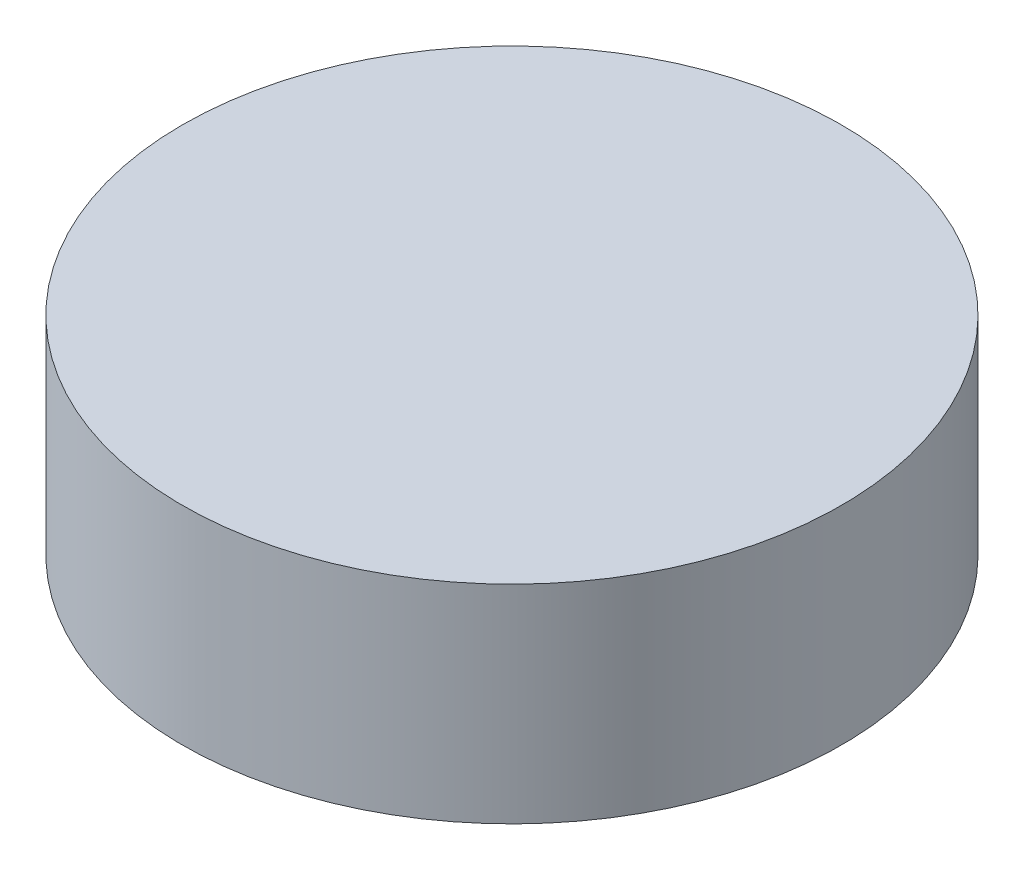
from build123d import *

# Parameters (mm, degrees)
SKETCH1_W = 6.35
SKETCH1_H = 4


with BuildPart() as part:
    # Sketch1 → Revolve1 (revolve)
    with BuildSketch(Plane.XY):
        with Locations((-3.175, 2)):
            Rectangle(SKETCH1_W, SKETCH1_H)
    revolve(axis=Axis((0, 4, 0), (0, -1, 0)))


solid = part.part
